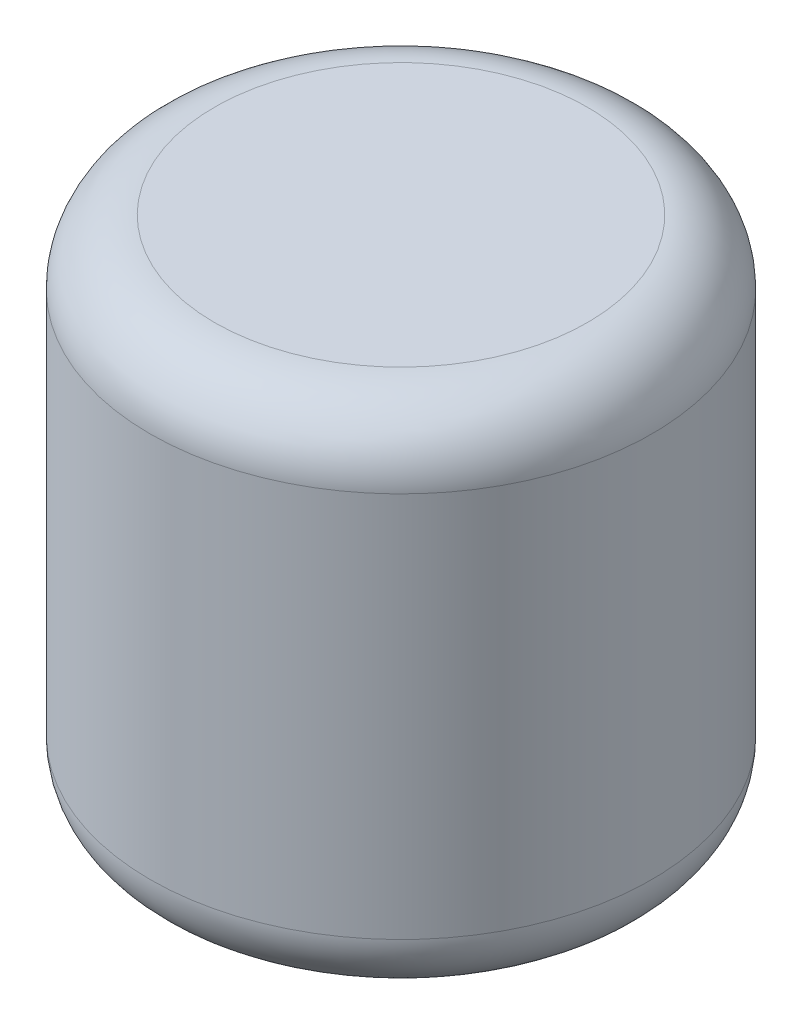
from build123d import *

# Parameters (mm, degrees)
SKETCH1_R           = 49.53
BOSS_EXTRUDE1_DEPTH = 101.6
FILLET1_R           = 12.7


with BuildPart() as part:
    # Sketch1 → Boss-Extrude1 (new body)
    with BuildSketch(Plane(origin=(0, 0, 0), x_dir=(1, 0, 0), z_dir=(0, 1, 0))):
        with Locations(Location((0, 0, 0), (0, 0, 270))):
            Circle(SKETCH1_R)
    extrude(amount=BOSS_EXTRUDE1_DEPTH)

    # Fillet1
    fillet1_edges = [part.edges().sort_by_distance(p)[0] for p in [
        (0, 0, -49.53),
        (0, 101.6, -49.53),
    ]]
    fillet(fillet1_edges, radius=FILLET1_R)


solid = part.part
